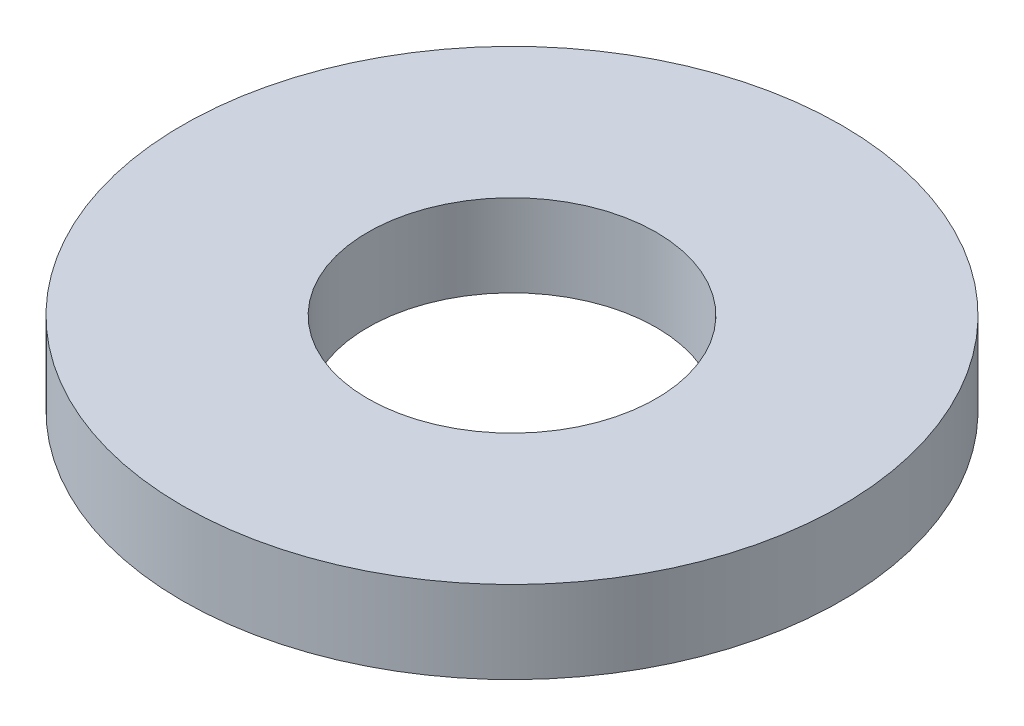
from build123d import *

# Parameters (mm, degrees)
SKETCH_1_R      = 4
SKETCH_1_R_2    = 1.75
EXTRUDE_1_DEPTH = 1


with BuildPart() as part:
    # 草图1 → 凸台-拉伸1 (new body)
    with BuildSketch(Plane(origin=(0, 0, 0), x_dir=(1, 0, 0), z_dir=(0, 1, 0))):
        with Locations(Location((0, 0, 0), (0, 0, 270))):
            Circle(SKETCH_1_R)
        with Locations(Location((0, 0, 0), (0, 0, 270))):
            Circle(SKETCH_1_R_2, mode=Mode.SUBTRACT)
    extrude(amount=EXTRUDE_1_DEPTH)


solid = part.part
